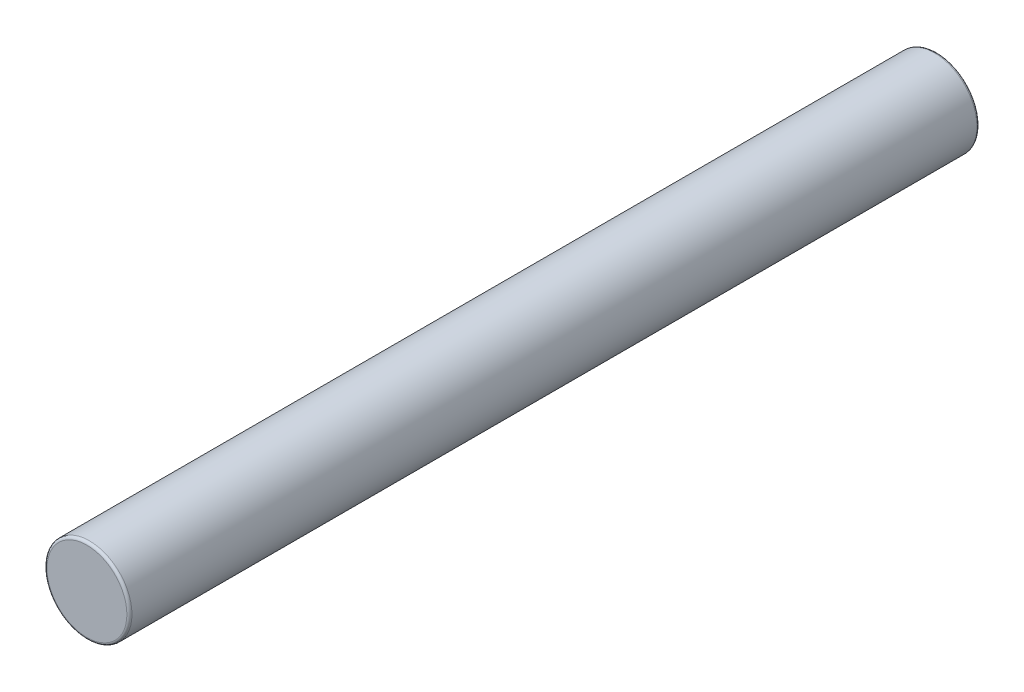
from build123d import *

# Parameters (mm, degrees)
SKETCH1_R           = 5
BOSS_EXTRUDE1_DEPTH = 50
FILLET1_R           = 0.3


with BuildPart() as part:
    # Sketch1 → Boss-Extrude1 (new, symmetric)
    with BuildSketch(Plane.XY):
        Circle(SKETCH1_R)
    extrude(amount=BOSS_EXTRUDE1_DEPTH, both=True)

    # Fillet1
    fillet1_edges = [part.edges().sort_by_distance(p)[0] for p in [
        (-5, 0, -50),
        (-5, 0, 50),
    ]]
    fillet(fillet1_edges, radius=FILLET1_R)


solid = part.part
